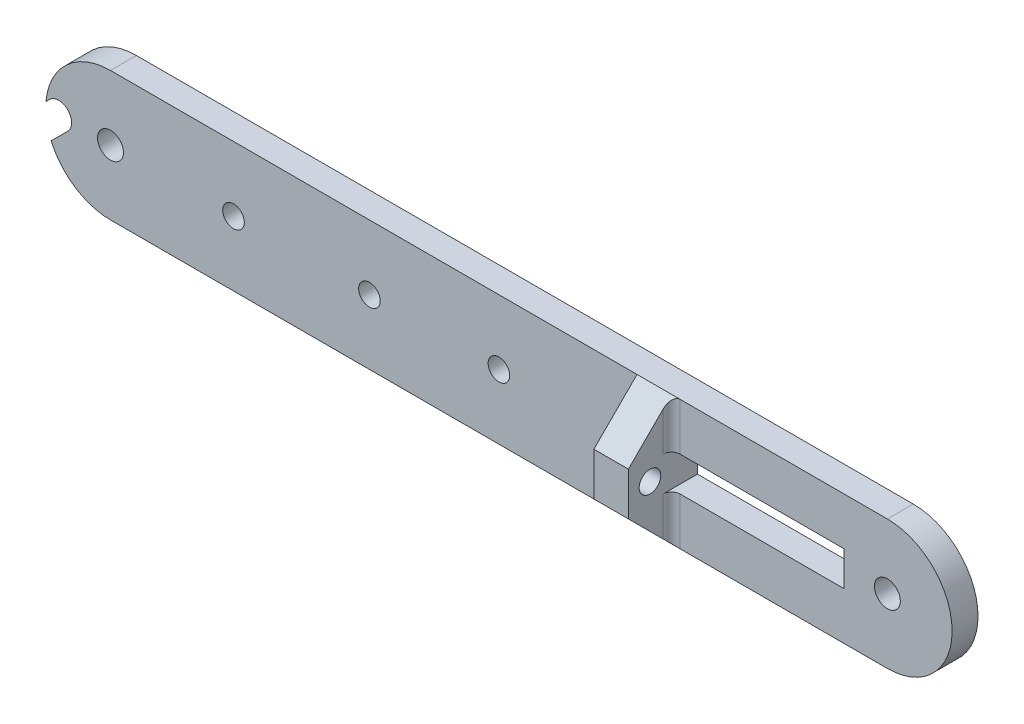
from build123d import *

# Parameters (mm, degrees)
ESQUISSE1_R             = 3
ESQUISSE1_R_2           = 2.5
ESQUISSE1_W             = 40
ESQUISSE1_H             = 8
BOSS_EXTRU_1_DEPTH      = 6
ESQUISSE2_R             = 2.5
BOSS_EXTRU_2_DEPTH      = 8
CONG_2_R                = 2
ENL_V_MAT_EXTRU_1_DEPTH = 4
ENL_V_START             = -10
ENL_V_MAT_EXTRU_4_DEPTH = 10


with BuildPart() as part:
    # Esquisse1 → Boss.-Extru.1 (new body)
    with BuildSketch(Plane.XY):
        with BuildLine():
            Line((90, -15), (-90, -15))
            ThreePointArc((-90, -15), (-105, 0), (-90, 15))
            Line((-90, 15), (90, 15))
            ThreePointArc((90, 15), (105, 0), (90, -15))
        make_face()
        with Locations((90, 0)):
            Circle(ESQUISSE1_R, mode=Mode.SUBTRACT)
        with Locations(Location((-90, 0, 0), (0, 0, 180))):
            Circle(ESQUISSE1_R, mode=Mode.SUBTRACT)
        Circle(ESQUISSE1_R_2, mode=Mode.SUBTRACT)
        with Locations((-61.5, 0)):
            Circle(ESQUISSE1_R_2, mode=Mode.SUBTRACT)
        with Locations((-30, 0)):
            Circle(ESQUISSE1_R_2, mode=Mode.SUBTRACT)
        with Locations((60, 0)):
            Rectangle(ESQUISSE1_W, ESQUISSE1_H, mode=Mode.SUBTRACT)
    extrude(amount=BOSS_EXTRU_1_DEPTH)

    # Esquisse2 → Boss.-Extru.2 (add)
    with BuildSketch(Plane(origin=(40, 0, 0), x_dir=(0, 0, -1), z_dir=(1, 0, 0))):
        Polygon((-16, 5), (-16, -5), (-6, -15), (-6, -5), (-6, 5), (-6, 15), align=None)
        with Locations((-11, 0)):
            Circle(ESQUISSE2_R, mode=Mode.SUBTRACT)
    extrude(amount=-BOSS_EXTRU_2_DEPTH)

    # Congé2
    cong_2_edges = [part.edges().sort_by_distance(p)[0] for p in [
        (40, 9.5, 6),
        (40, -9.5, 6),
    ]]
    fillet(cong_2_edges, radius=CONG_2_R)

    # Esquisse3 → Enlèv. mat.-Extru.1 (cut)
    with BuildSketch(Plane.ZY.offset(-32)):
        Polygon((11, 4), (14.464101615, 2), (14.464101615, -2), (11, -4), (7.535898385, -2), (7.535898385, 2), align=None)
    extrude(amount=-ENL_V_MAT_EXTRU_1_DEPTH, mode=Mode.SUBTRACT)

    # Esquisse4 → Enlèv. mat.-Extru.4 (cut)
    with BuildSketch(Plane.XY.offset(6).offset(ENL_V_START)):
        with BuildLine():
            ThreePointArc((-105, -2.6e-08), (-103.148050285, -2.771638603), (-99.878679656, -2.121320344))
            Line((-99.878679656, -2.121320344), (-104.121320344, 2.121320344))
            ThreePointArc((-104.121320344, 2.121320344), (-104.771638603, 1.148050285), (-105, -2.6e-08))
        make_face()
        with BuildLine():
            Line((-104.121320344, 2.121320344), (-99.878679656, -2.121320344))
            ThreePointArc((-99.878679656, -2.121320344), (-99.228361402, -1.148050297), (-99, 0))
            ThreePointArc((-99, 0), (-100.851949703, 2.771638598), (-104.121320344, 2.121320344))
        make_face()
        with BuildLine():
            ThreePointArc((-105, -2.6e-08), (-104.771638603, 1.148050285), (-104.121320344, 2.121320344))
            Line((-104.121320344, 2.121320344), (-104.94364809, 1.298992597))
            ThreePointArc((-104.94364809, 1.298992597), (-104.985905401, 0.650107152), (-105, -2.6e-08))
        make_face()
        with BuildLine():
            Line((-103.750652313, -5.993293), (-99.878679656, -2.121320344))
            ThreePointArc((-99.878679656, -2.121320344), (-103.148050285, -2.771638603), (-105, -2.6e-08))
            ThreePointArc((-105, -2.6e-08), (-104.684341738, -3.061063171), (-103.750652313, -5.993293))
        make_face()
        with BuildLine():
            ThreePointArc((-105, -2.6e-08), (-103.148050285, -2.771638603), (-99.878679656, -2.121320344))
            Line((-99.878679656, -2.121320344), (-104.121320344, 2.121320344))
            ThreePointArc((-104.121320344, 2.121320344), (-104.771638603, 1.148050285), (-105, -2.6e-08))
        make_face()
        with BuildLine():
            Line((-104.121320344, 2.121320344), (-99.878679656, -2.121320344))
            ThreePointArc((-99.878679656, -2.121320344), (-99.228361402, -1.148050297), (-99, 0))
            ThreePointArc((-99, 0), (-100.851949703, 2.771638598), (-104.121320344, 2.121320344))
        make_face()
    extrude(amount=ENL_V_MAT_EXTRU_4_DEPTH, mode=Mode.SUBTRACT)


solid = part.part
